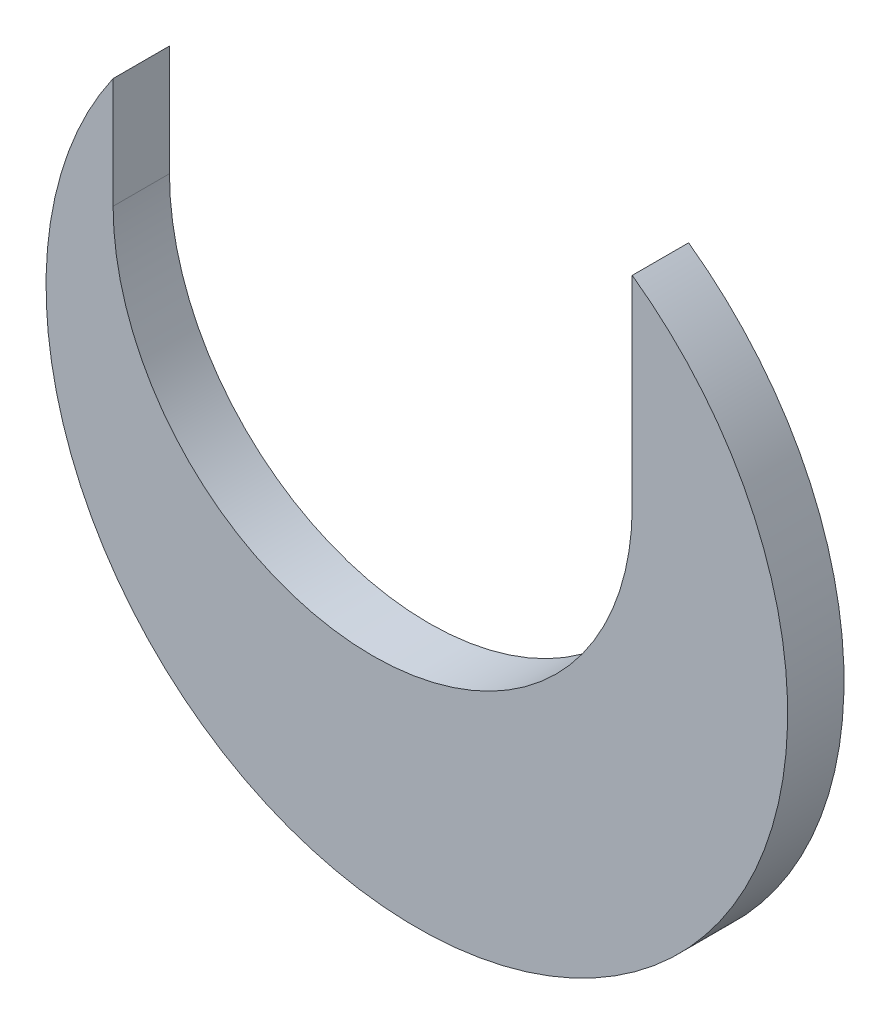
from build123d import *

# Parameters (mm, degrees)
BOSS_EXTRUDE1_DEPTH = 4.826


with BuildPart() as part:
    # Sketch1 → Boss-Extrude1 (new body)
    with BuildSketch(Plane.XY):
        with BuildLine():
            ThreePointArc((18.442512073, 8.741762413), (-3.782487927, -13.483237587), (-26.007487927, 8.741762413))
            Line((-26.007487927, 8.741762413), (-26.007487927, 18.211893689))
            ThreePointArc((-26.007487927, 18.211893689), (-9.547899201, -30.280358664), (31.75, 0))
            ThreePointArc((31.75, 0), (28.227754589, 14.534661016), (18.442512073, 25.844462626))
            Line((18.442512073, 25.844462626), (18.442512073, 8.741762413))
        make_face()
    extrude(amount=BOSS_EXTRUDE1_DEPTH)


solid = part.part
